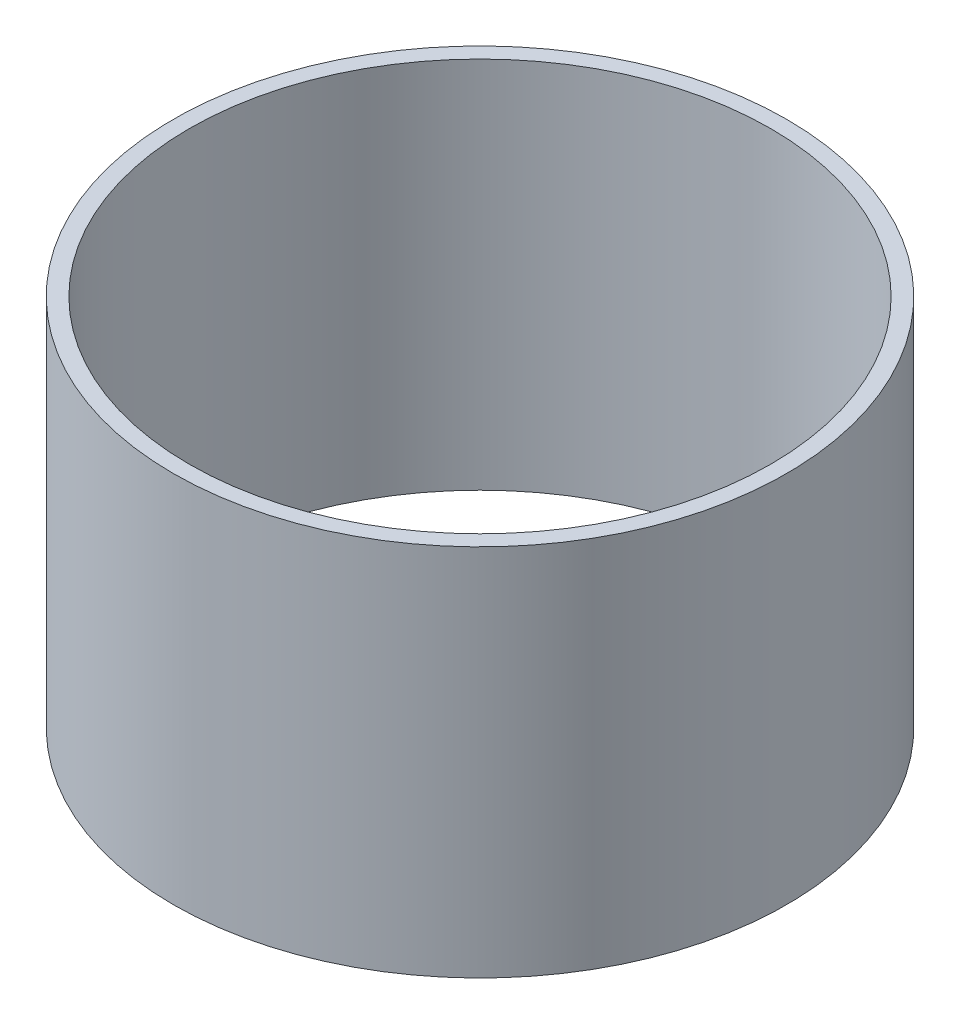
from build123d import *

# Parameters (mm, degrees)
SKETCH1_R           = 57.5
SKETCH1_R_2         = 54.5
BOSS_EXTRUDE1_DEPTH = 70


with BuildPart() as part:
    # Sketch1 → Boss-Extrude1 (new body)
    with BuildSketch(Plane(origin=(0, 0, 0), x_dir=(1, 0, 0), z_dir=(0, 1, 0))):
        with Locations(Location((0, 0, 0), (0, 0, 270))):
            Circle(SKETCH1_R)
        with Locations(Location((0, 0, 0), (0, 0, 270))):
            Circle(SKETCH1_R_2, mode=Mode.SUBTRACT)
    extrude(amount=BOSS_EXTRUDE1_DEPTH)


solid = part.part
